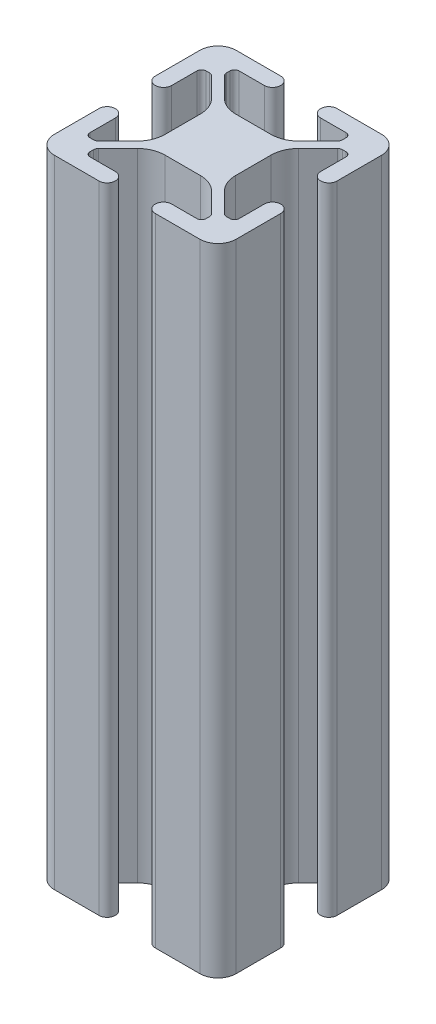
from build123d import *

# Parameters (mm, degrees)
EXTRUDE_1_DEPTH = 70


with BuildPart() as part:
    # 草图1 → 凸台-拉伸1 (new body)
    with BuildSketch(Plane(origin=(0, 0, 0), x_dir=(1, 0, 0), z_dir=(0, 1, 0))):
        with BuildLine():
            Line((-1.042752475, -10.085861632), (3.857247525, -10.085861632))
            ThreePointArc((3.857247525, -10.085861632), (4.757247525, -10.985861632), (3.857247525, -11.885861632))
            Line((3.857247525, -11.885861632), (1.076161722, -11.885861632))
            ThreePointArc((1.076161722, -11.885861632), (0.722608332, -12.032308241), (0.576161722, -12.385861632))
            Line((0.576161722, -12.385861632), (0.576161722, -12.790788968))
            ThreePointArc((0.576161722, -12.790788968), (0.614221956, -12.982130685), (0.722608332, -13.144342359))
            Line((0.722608332, -13.144342359), (2.885447948, -15.307181975))
            ThreePointArc((2.885447948, -15.307181975), (3.858717994, -15.957500229), (5.006768291, -16.185861632))
            Line((5.006768291, -16.185861632), (8.907726758, -16.185861632))
            ThreePointArc((8.907726758, -16.185861632), (10.055777055, -15.957500229), (11.029047102, -15.307181975))
            Line((11.029047102, -15.307181975), (13.191886718, -13.144342359))
            ThreePointArc((13.191886718, -13.144342359), (13.300273094, -12.982130685), (13.338333327, -12.790788968))
            Line((13.338333327, -12.790788968), (13.338333327, -12.385861632))
            ThreePointArc((13.338333327, -12.385861632), (13.191886718, -12.032308241), (12.838333327, -11.885861632))
            Line((12.838333327, -11.885861632), (10.057247525, -11.885861632))
            ThreePointArc((10.057247525, -11.885861632), (9.157247525, -10.985861632), (10.057247525, -10.085861632))
            Line((10.057247525, -10.085861632), (14.957247525, -10.085861632))
            ThreePointArc((14.957247525, -10.085861632), (16.371461087, -10.671648069), (16.957247525, -12.085861632))
            Line((16.957247525, -12.085861632), (16.957247525, -16.985861632))
            ThreePointArc((16.957247525, -16.985861632), (16.057247525, -17.885861632), (15.157247525, -16.985861632))
            Line((15.157247525, -16.985861632), (15.157247525, -14.204775829))
            ThreePointArc((15.157247525, -14.204775829), (15.010800915, -13.851222438), (14.657247525, -13.704775829))
            Line((14.657247525, -13.704775829), (14.252320188, -13.704775829))
            ThreePointArc((14.252320188, -13.704775829), (14.060978472, -13.742836063), (13.898766797, -13.851222438))
            Line((13.898766797, -13.851222438), (11.735927181, -16.014062054))
            ThreePointArc((11.735927181, -16.014062054), (11.085608927, -16.987332101), (10.857247525, -18.135382398))
            Line((10.857247525, -18.135382398), (10.857247525, -22.036340865))
            ThreePointArc((10.857247525, -22.036340865), (11.085608927, -23.184391162), (11.735927181, -24.157661209))
            Line((11.735927181, -24.157661209), (13.898766797, -26.320500825))
            ThreePointArc((13.898766797, -26.320500825), (14.060978472, -26.4288872), (14.252320188, -26.466947434))
            Line((14.252320188, -26.466947434), (14.657247525, -26.466947434))
            ThreePointArc((14.657247525, -26.466947434), (15.010800915, -26.320500825), (15.157247525, -25.966947434))
            Line((15.157247525, -25.966947434), (15.157247525, -23.185861632))
            ThreePointArc((15.157247525, -23.185861632), (16.057247525, -22.285861632), (16.957247525, -23.185861632))
            Line((16.957247525, -23.185861632), (16.957247525, -28.085861632))
            ThreePointArc((16.957247525, -28.085861632), (16.371461087, -29.500075194), (14.957247525, -30.085861632))
            Line((14.957247525, -30.085861632), (10.057247525, -30.085861632))
            ThreePointArc((10.057247525, -30.085861632), (9.157247525, -29.185861632), (10.057247525, -28.285861632))
            Line((10.057247525, -28.285861632), (12.838333327, -28.285861632))
            ThreePointArc((12.838333327, -28.285861632), (13.191886718, -28.139415022), (13.338333327, -27.785861632))
            Line((13.338333327, -27.785861632), (13.338333327, -27.380934295))
            ThreePointArc((13.338333327, -27.380934295), (13.300273094, -27.189592579), (13.191886718, -27.027380904))
            Line((13.191886718, -27.027380904), (11.029047102, -24.864541288))
            ThreePointArc((11.029047102, -24.864541288), (10.055777055, -24.214223034), (8.907726758, -23.985861632))
            Line((8.907726758, -23.985861632), (5.006768291, -23.985861632))
            ThreePointArc((5.006768291, -23.985861632), (3.858717994, -24.214223034), (2.885447948, -24.864541288))
            Line((2.885447948, -24.864541288), (0.722608332, -27.027380904))
            ThreePointArc((0.722608332, -27.027380904), (0.614221956, -27.189592579), (0.576161722, -27.380934295))
            Line((0.576161722, -27.380934295), (0.576161722, -27.785861632))
            ThreePointArc((0.576161722, -27.785861632), (0.722608332, -28.139415022), (1.076161722, -28.285861632))
            Line((1.076161722, -28.285861632), (3.857247525, -28.285861632))
            ThreePointArc((3.857247525, -28.285861632), (4.757247525, -29.185861632), (3.857247525, -30.085861632))
            Line((3.857247525, -30.085861632), (-1.042752475, -30.085861632))
            ThreePointArc((-1.042752475, -30.085861632), (-2.456966038, -29.500075194), (-3.042752475, -28.085861632))
            Line((-3.042752475, -28.085861632), (-3.042752475, -23.185861632))
            ThreePointArc((-3.042752475, -23.185861632), (-2.142752475, -22.285861632), (-1.242752475, -23.185861632))
            Line((-1.242752475, -23.185861632), (-1.242752475, -25.966947434))
            ThreePointArc((-1.242752475, -25.966947434), (-1.096305866, -26.320500825), (-0.742752475, -26.466947434))
            Line((-0.742752475, -26.466947434), (-0.337825138, -26.466947434))
            ThreePointArc((-0.337825138, -26.466947434), (-0.146483422, -26.4288872), (0.015728252, -26.320500825))
            Line((0.015728252, -26.320500825), (2.178567868, -24.157661209))
            ThreePointArc((2.178567868, -24.157661209), (2.828886122, -23.184391162), (3.057247525, -22.036340865))
            Line((3.057247525, -22.036340865), (3.057247525, -18.135382398))
            ThreePointArc((3.057247525, -18.135382398), (2.828886122, -16.987332101), (2.178567868, -16.014062054))
            Line((2.178567868, -16.014062054), (0.015728252, -13.851222438))
            ThreePointArc((0.015728252, -13.851222438), (-0.146483422, -13.742836063), (-0.337825138, -13.704775829))
            Line((-0.337825138, -13.704775829), (-0.742752475, -13.704775829))
            ThreePointArc((-0.742752475, -13.704775829), (-1.096305866, -13.851222438), (-1.242752475, -14.204775829))
            Line((-1.242752475, -14.204775829), (-1.242752475, -16.985861632))
            ThreePointArc((-1.242752475, -16.985861632), (-2.142752475, -17.885861632), (-3.042752475, -16.985861632))
            Line((-3.042752475, -16.985861632), (-3.042752475, -12.085861632))
            ThreePointArc((-3.042752475, -12.085861632), (-2.456966038, -10.671648069), (-1.042752475, -10.085861632))
        make_face()
    extrude(amount=EXTRUDE_1_DEPTH)


solid = part.part
